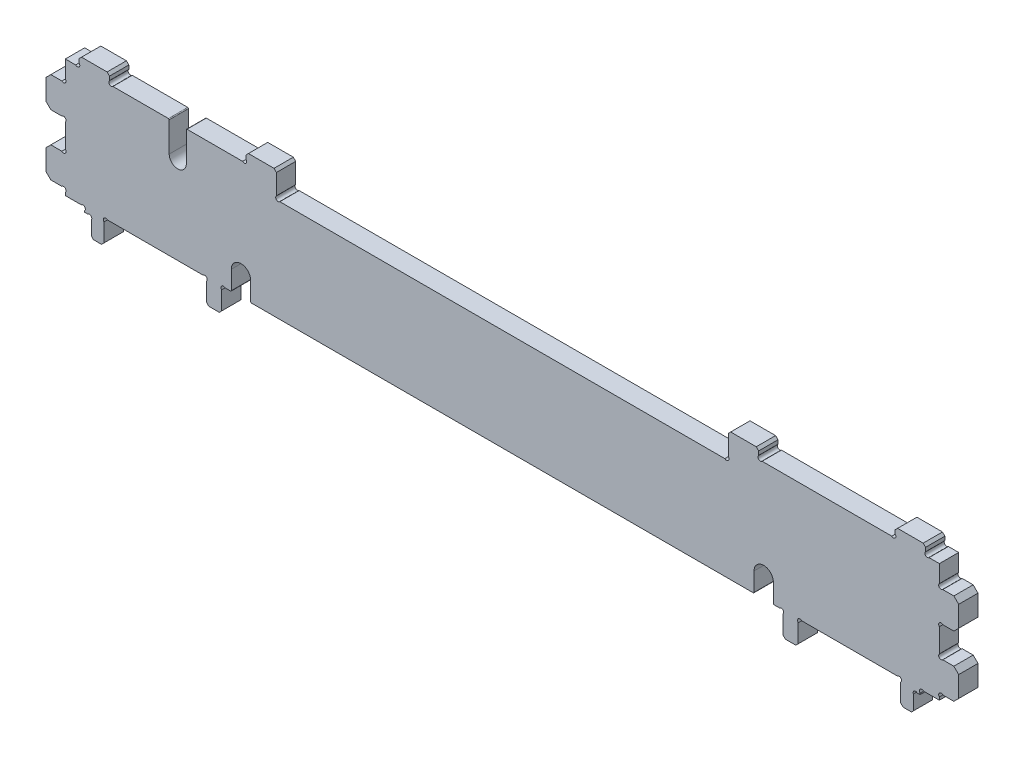
from build123d import *

# Parameters (mm, degrees)
BOSS_EXTRUDE1_DEPTH = 6.35
CUT_EXTRUDE2_DEPTH  = 169.008101823
CUT_EXTRUDE3_DEPTH  = 169.008101823
CUT_EXTRUDE4_DEPTH  = 169.008101823
FILLET1_R           = 0.254


with BuildPart() as part:
    # Model → Boss-Extrude1 (new body)
    with BuildSketch(Plane.XY):
        with BuildLine():
            Line((138.15521867, -67.612541882), (138.94896867, -66.818791882))
            Line((138.94896867, -66.818791882), (138.94896867, -62.385073899))
            ThreePointArc((138.94896867, -62.385073899), (138.948968669, -61.262541883), (140.071500684, -61.262541882))
            Line((140.071500684, -61.262541882), (140.971545702, -61.262541882))
            Line((140.971545702, -61.262541882), (140.971545702, -60.810273899))
            ThreePointArc((140.971545702, -60.810273899), (140.9715457, -59.687741883), (142.094077716, -59.687741882))
            Line((142.094077716, -59.687741882), (147.321545702, -59.687741882))
            Line((147.321545702, -59.687741882), (147.321545702, -58.735073899))
            ThreePointArc((147.321545702, -58.735073899), (147.3215457, -57.612541883), (148.444077716, -57.612541882))
            Line((148.444077716, -57.612541882), (152.084045702, -57.612541882))
            Line((152.084045702, -57.612541882), (153.671545702, -56.025041882))
            Line((153.671545702, -56.025041882), (153.671545702, -49.200041882))
            Line((153.671545702, -49.200041882), (152.084045702, -47.612541882))
            Line((152.084045702, -47.612541882), (148.444077716, -47.612541882))
            ThreePointArc((148.444077716, -47.612541882), (147.321545702, -47.612541882), (147.321545702, -46.490009867))
            Line((147.321545702, -46.490009867), (147.321545702, -38.735073899))
            ThreePointArc((147.321545702, -38.735073899), (147.3215457, -37.612541883), (148.444077716, -37.612541882))
            Line((148.444077716, -37.612541882), (152.084045702, -37.612541882))
            Line((152.084045702, -37.612541882), (153.671545702, -36.025041882))
            Line((153.671545702, -36.025041882), (153.671545702, -29.200041882))
            Line((153.671545702, -29.200041882), (152.084045702, -27.612541882))
            Line((152.084045702, -27.612541882), (148.444077716, -27.612541882))
            ThreePointArc((148.444077716, -27.612541882), (147.321545702, -27.612541882), (147.321545702, -26.490009867))
            Line((147.321545702, -26.490009867), (147.321545702, -20.787541882))
            Line((147.321545702, -20.787541882), (143.919077716, -20.787541882))
            ThreePointArc((143.919077716, -20.787541882), (142.796545702, -20.787541882), (142.796545702, -19.665009867))
            Line((142.796545702, -19.665009867), (142.796545702, -18.406291882))
            Line((142.796545702, -18.406291882), (142.002795702, -17.612541882))
            Line((142.002795702, -17.612541882), (133.590295702, -17.612541882))
            Line((133.590295702, -17.612541882), (132.796545702, -18.406291882))
            Line((132.796545702, -18.406291882), (132.796545702, -19.665009867))
            ThreePointArc((132.796545702, -19.665009867), (132.796545702, -20.787541882), (131.674013687, -20.787541882))
            Line((131.674013687, -20.787541882), (89.055077716, -20.787541882))
            ThreePointArc((89.055077716, -20.787541882), (87.932545702, -20.787541882), (87.932545702, -19.665009867))
            Line((87.932545702, -19.665009867), (87.932545702, -18.406291882))
            Line((87.932545702, -18.406291882), (87.138795702, -17.612541882))
            Line((87.138795702, -17.612541882), (78.726295702, -17.612541882))
            Line((78.726295702, -17.612541882), (77.932545702, -18.406291882))
            Line((77.932545702, -18.406291882), (77.932545702, -25.037209867))
            ThreePointArc((77.932545702, -25.037209867), (77.932545702, -26.159741882), (76.810013687, -26.159741882))
            Line((76.810013687, -26.159741882), (-69.46692228, -26.159741882))
            ThreePointArc((-69.46692228, -26.159741882), (-70.589454296, -26.159741883), (-70.589454297, -25.037209867))
            Line((-70.589454297, -25.037209867), (-70.589454297, -18.406291882))
            Line((-70.589454297, -18.406291882), (-71.383204297, -17.612541882))
            Line((-71.383204297, -17.612541882), (-79.795704297, -17.612541882))
            Line((-79.795704297, -17.612541882), (-80.589454297, -18.406291882))
            Line((-80.589454297, -18.406291882), (-80.589454297, -19.665009867))
            ThreePointArc((-80.589454297, -19.665009867), (-80.589454297, -20.787541882), (-81.711986312, -20.787541882))
            Line((-81.711986312, -20.787541882), (-100.521454296, -20.787541882))
            Line((-100.521454296, -20.787541882), (-100.521454296, -29.665009867))
            ThreePointArc((-100.521454296, -29.665009867), (-100.521454296, -30.787541882), (-101.64398631, -30.787541882))
            Line((-101.64398631, -30.787541882), (-104.398922281, -30.787541882))
            ThreePointArc((-104.398922281, -30.787541882), (-105.521454296, -30.787541882), (-105.521454296, -29.665009867))
            Line((-105.521454296, -29.665009867), (-105.521454296, -20.787541882))
            Line((-105.521454296, -20.787541882), (-124.33092228, -20.787541882))
            ThreePointArc((-124.33092228, -20.787541882), (-125.453454296, -20.787541883), (-125.453454297, -19.665009867))
            Line((-125.453454297, -19.665009867), (-125.453454297, -18.406291882))
            Line((-125.453454297, -18.406291882), (-126.247204297, -17.612541882))
            Line((-126.247204297, -17.612541882), (-134.659704297, -17.612541882))
            Line((-134.659704297, -17.612541882), (-135.453454297, -18.406291882))
            Line((-135.453454297, -18.406291882), (-135.453454297, -19.665009867))
            ThreePointArc((-135.453454297, -19.665009867), (-135.453454297, -20.787541882), (-136.575986312, -20.787541882))
            Line((-136.575986312, -20.787541882), (-139.978454297, -20.787541882))
            Line((-139.978454297, -20.787541882), (-139.978454297, -26.490009867))
            ThreePointArc((-139.978454297, -26.490009867), (-139.978454297, -27.612541882), (-141.100986312, -27.612541882))
            Line((-141.100986312, -27.612541882), (-144.740954297, -27.612541882))
            Line((-144.740954297, -27.612541882), (-146.328454297, -29.200041882))
            Line((-146.328454297, -29.200041882), (-146.328454297, -36.025041882))
            Line((-146.328454297, -36.025041882), (-144.740954297, -37.612541882))
            Line((-144.740954297, -37.612541882), (-141.100986312, -37.612541882))
            ThreePointArc((-141.100986312, -37.612541882), (-139.978454296, -37.612541883), (-139.978454297, -38.735073899))
            Line((-139.978454297, -38.735073899), (-139.978454297, -46.490009867))
            ThreePointArc((-139.978454297, -46.490009867), (-139.978454297, -47.612541882), (-141.100986312, -47.612541882))
            Line((-141.100986312, -47.612541882), (-144.740954297, -47.612541882))
            Line((-144.740954297, -47.612541882), (-146.328454297, -49.200041882))
            Line((-146.328454297, -49.200041882), (-146.328454297, -56.025041882))
            Line((-146.328454297, -56.025041882), (-144.740954297, -57.612541882))
            Line((-144.740954297, -57.612541882), (-141.100986312, -57.612541882))
            ThreePointArc((-141.100986312, -57.612541882), (-139.978454296, -57.612541883), (-139.978454297, -58.735073899))
            Line((-139.978454297, -58.735073899), (-139.978454297, -59.687741882))
            Line((-139.978454297, -59.687741882), (-134.750986312, -59.687741882))
            ThreePointArc((-134.750986312, -59.687741882), (-133.628454296, -59.687741883), (-133.628454297, -60.810273899))
            Line((-133.628454297, -60.810273899), (-133.628454297, -61.262541882))
            Line((-133.628454297, -61.262541882), (-132.630226339, -61.262541882))
            ThreePointArc((-132.630226339, -61.262541882), (-131.507694322, -61.262541882), (-131.507694322, -62.385073899))
            Line((-131.507694322, -62.385073899), (-131.507694322, -66.818791882))
            Line((-131.507694322, -66.818791882), (-130.713944322, -67.612541882))
            Line((-130.713944322, -67.612541882), (-128.072204297, -67.612541882))
            Line((-128.072204297, -67.612541882), (-127.278454297, -66.818791882))
            Line((-127.278454297, -66.818791882), (-127.278454297, -60.810273899))
            ThreePointArc((-127.278454297, -60.810273899), (-127.278454298, -59.687741883), (-126.155922283, -59.687741882))
            Line((-126.155922283, -59.687741882), (-94.70598631, -59.687741882))
            ThreePointArc((-94.70598631, -59.687741882), (-93.583454294, -59.687741883), (-93.583454296, -60.810273899))
            Line((-93.583454296, -60.810273899), (-93.583454296, -66.818791882))
            Line((-93.583454296, -66.818791882), (-92.789704296, -67.612541882))
            Line((-92.789704296, -67.612541882), (-89.377204296, -67.612541882))
            Line((-89.377204296, -67.612541882), (-88.583454296, -66.818791882))
            Line((-88.583454296, -66.818791882), (-88.583454296, -60.810273899))
            ThreePointArc((-88.583454296, -60.810273899), (-88.583454297, -59.687741883), (-87.460922281, -59.687741882))
            Line((-87.460922281, -59.687741882), (94.804013689, -59.687741882))
            ThreePointArc((94.804013689, -59.687741882), (95.926545704, -59.687741883), (95.926545703, -60.810273899))
            Line((95.926545703, -60.810273899), (95.926545703, -66.818791882))
            Line((95.926545703, -66.818791882), (96.720295703, -67.612541882))
            Line((96.720295703, -67.612541882), (100.132795703, -67.612541882))
            Line((100.132795703, -67.612541882), (100.926545703, -66.818791882))
            Line((100.926545703, -66.818791882), (100.926545703, -60.810273899))
            ThreePointArc((100.926545703, -60.810273899), (100.926545702, -59.687741883), (102.049077718, -59.687741882))
            Line((102.049077718, -59.687741882), (133.499013687, -59.687741882))
            ThreePointArc((133.499013687, -59.687741882), (134.621545703, -59.687741883), (134.621545702, -60.810273899))
            Line((134.621545702, -60.810273899), (134.621545702, -66.818791882))
            Line((134.621545702, -66.818791882), (135.415295702, -67.612541882))
            Line((135.415295702, -67.612541882), (138.15521867, -67.612541882))
        make_face()
    extrude(amount=BOSS_EXTRUDE1_DEPTH)

    # Sketch3 → Cut-Extrude2 (cut, through all)
    with BuildSketch(Plane.XY.offset(6.35)):
        with BuildLine():
            Line((-131.355294322, -62.171255574), (-131.355294322, -66.971191882))
            Line((-131.355294322, -66.971191882), (-131.507694322, -66.818791882))
            Line((-131.507694322, -66.818791882), (-131.507694322, -62.385073899))
            ThreePointArc((-131.507694322, -62.385073899), (-131.422591643, -62.284510162), (-131.355294322, -62.171255574))
        make_face()
        with BuildLine():
            Line((138.79656867, -62.171255574), (138.79656867, -66.971191882))
            Line((138.79656867, -66.971191882), (138.94896867, -66.818791882))
            Line((138.94896867, -66.818791882), (138.94896867, -62.385073899))
            ThreePointArc((138.94896867, -62.385073899), (138.86386599, -62.284510163), (138.79656867, -62.171255574))
        make_face()
    extrude(amount=-CUT_EXTRUDE2_DEPTH, mode=Mode.SUBTRACT)

    # Sketch4 → Cut-Extrude3 (cut, through all)
    with BuildSketch(Plane.XY.offset(6.35)):
        with BuildLine():
            Line((-85.408454296, -59.687741882), (-79.058454296, -59.687741882))
            Line((-79.058454296, -59.687741882), (-79.058454296, -53.337741882))
            ThreePointArc((-79.058454296, -53.337741882), (-82.233454296, -50.162741882), (-85.408454296, -53.337741882))
            Line((-85.408454296, -53.337741882), (-85.408454296, -59.687741882))
        make_face()
        with BuildLine():
            Line((86.4015457, -59.687741882), (86.4015457, -53.337741882))
            ThreePointArc((86.4015457, -53.337741882), (89.5765457, -50.162741882), (92.751545701, -53.337741882))
            Line((92.751545701, -53.337741882), (92.751545701, -59.687741882))
            Line((92.751545701, -59.687741882), (86.4015457, -59.687741882))
        make_face()
    extrude(amount=-CUT_EXTRUDE3_DEPTH, mode=Mode.SUBTRACT)

    # Sketch6 → Cut-Extrude4 (cut, through all)
    with BuildSketch(Plane.XY.offset(6.35)):
        with BuildLine():
            Line((-105.833547434, -30.787541882), (-105.833547434, -20.787541882))
            Line((-105.833547434, -20.787541882), (-100.209361158, -20.787541882))
            Line((-100.209361158, -20.787541882), (-100.209361158, -30.787541882))
            ThreePointArc((-100.209361158, -30.787541882), (-103.021454296, -33.59963502), (-105.833547434, -30.787541882))
        make_face()
    extrude(amount=-CUT_EXTRUDE4_DEPTH, mode=Mode.SUBTRACT)

    # Fillet1
    fillet1_edges = [part.edges().sort_by_distance(p)[0] for p in [
        (-85.408454296, -59.687741882, 3.175),
        (-79.058454296, -59.687741882, 3.175),
        (92.751545701, -59.687741882, 3.175),
        (86.4015457, -59.687741882, 3.175),
        (-105.833547434, -20.787541882, 3.175),
        (-100.209361158, -20.787541882, 3.175),
    ]]
    fillet(fillet1_edges, radius=FILLET1_R)


solid = part.part
